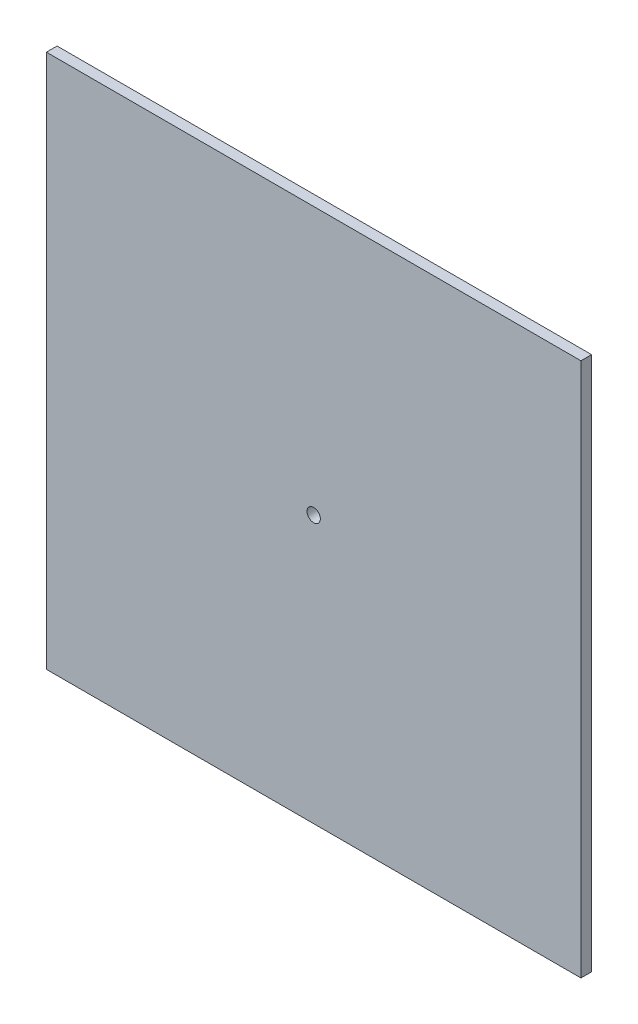
from build123d import *

# Parameters (mm, degrees)
SKETCH1_W           = 200.8
SKETCH1_H           = 200.8
SKETCH1_R           = 2.5
BOSS_EXTRUDE2_DEPTH = 4


with BuildPart() as part:
    # Sketch1 → Boss-Extrude2 (new body)
    with BuildSketch(Plane.XY):
        Rectangle(SKETCH1_W, SKETCH1_H)
        Circle(SKETCH1_R, mode=Mode.SUBTRACT)
    extrude(amount=BOSS_EXTRUDE2_DEPTH)


solid = part.part
